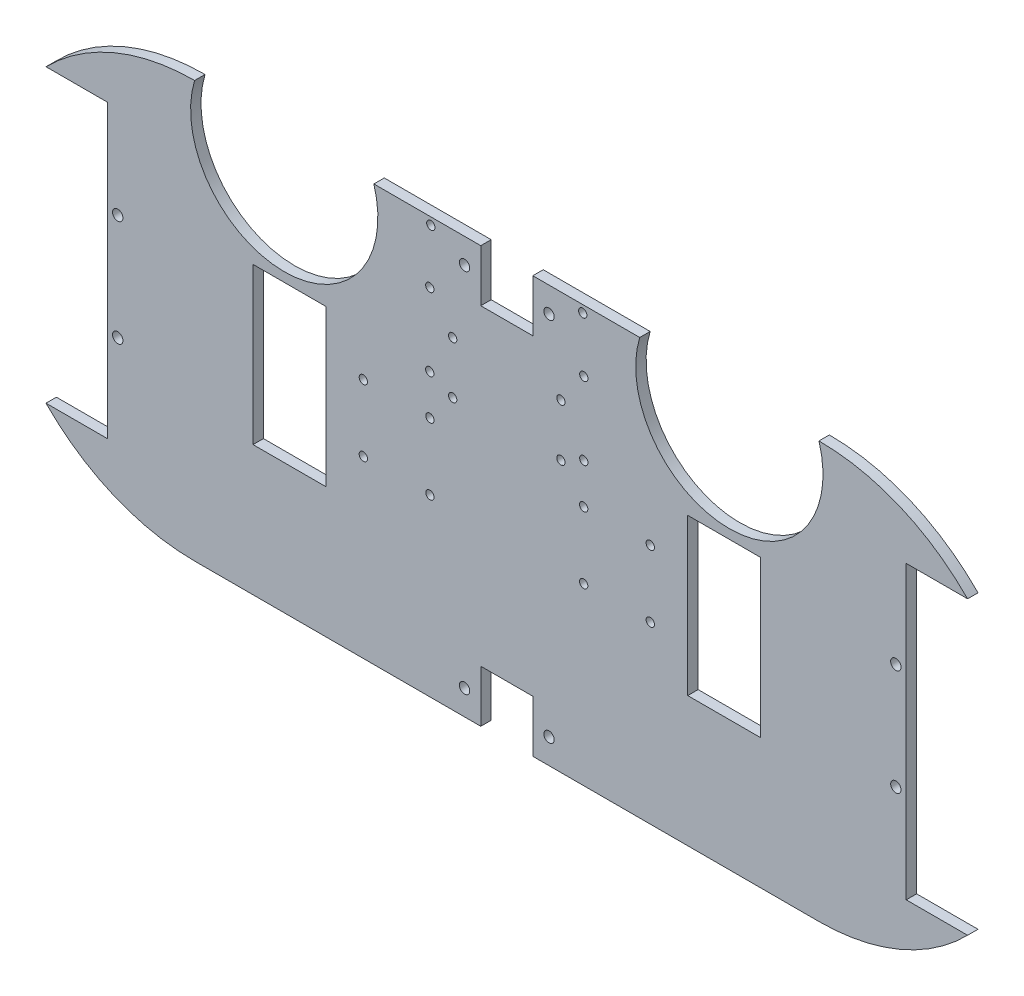
from build123d import *

# Parameters (mm, degrees)
SKETCH1_R           = 2
BOSS_EXTRUDE1_DEPTH = 5
SKETCH2_R           = 2.5
SKETCH2_W           = 35
SKETCH2_H           = 75
CUT_EXTRUDE1_DEPTH  = 10
SKETCH4_R           = 2
CUT_EXTRUDE3_DEPTH  = 10
SKETCH5_R           = 2.5
CUT_EXTRUDE4_DEPTH  = 10
SKETCH6_W           = 25
SKETCH6_H           = 25
CUT_EXTRUDE5_DEPTH  = 10


with BuildPart() as part:
    # Sketch1 → Boss-Extrude1 (new body)
    with BuildSketch(Plane.XY):
        with BuildLine():
            Line((77, 150.635083269), (106.477021815, 150.635083269))
            ThreePointArc((106.477021815, 150.635083269), (73.792570992, 172.830527842), (35.06273753, 180.635083269))
            ThreePointArc((35.06273753, 180.635083269), (-7.999345575, 122.571508006), (-51.06142868, 180.635083269))
            Line((-51.06142868, 180.635083269), (-178.81309626, 180.635083269))
            ThreePointArc((-178.81309626, 180.635083269), (-221.875179365, 122.571508006), (-264.93726247, 180.635083269))
            ThreePointArc((-264.93726247, 180.635083269), (-303.667095932, 172.830527842), (-336.351546756, 150.635083269))
            Line((-336.351546756, 150.635083269), (-306.874524941, 150.635083269))
            Line((-306.874524941, 150.635083269), (-306.874524941, 10.635083269))
            Line((-306.874524941, 10.635083269), (-336.351546756, 10.635083269))
            ThreePointArc((-336.351546756, 10.635083269), (-303.667095932, -11.560361304), (-264.93726247, -19.364916731))
            Line((-264.93726247, -19.364916731), (35.06273753, -19.364916731))
            ThreePointArc((35.06273753, -19.364916731), (73.792570992, -11.560361304), (106.477021815, 10.635083269))
            Line((106.477021815, 10.635083269), (77, 10.635083269))
            Line((77, 10.635083269), (77, 150.635083269))
        make_face()
        with Locations((-151.935, 116.015296492)):
            Circle(SKETCH1_R, mode=Mode.SUBTRACT)
        with Locations((-140.936318375, 110.635083269)):
            Circle(SKETCH1_R, mode=Mode.SUBTRACT)
        with Locations((-140.936318375, 135.635083269)):
            Circle(SKETCH1_R, mode=Mode.SUBTRACT)
        with Locations((-151.935, 151.015296492)):
            Circle(SKETCH1_R, mode=Mode.SUBTRACT)
        with Locations((-151.436318375, 177.135083269)):
            Circle(SKETCH1_R, mode=Mode.SUBTRACT)
        with Locations((-88.936318375, 110.635083269)):
            Circle(SKETCH1_R, mode=Mode.SUBTRACT)
        with Locations((-77.935, 116.015296492)):
            Circle(SKETCH1_R, mode=Mode.SUBTRACT)
        with Locations((-88.936318375, 135.635083269)):
            Circle(SKETCH1_R, mode=Mode.SUBTRACT)
        with Locations((-77.935, 151.015296492)):
            Circle(SKETCH1_R, mode=Mode.SUBTRACT)
        with Locations((-78.436318375, 177.135083269)):
            Circle(SKETCH1_R, mode=Mode.SUBTRACT)
    extrude(amount=-BOSS_EXTRUDE1_DEPTH)

    # Sketch2 → Cut-Extrude1 (cut)
    with BuildSketch(Plane(origin=(0, 0, -5), x_dir=(-1, 0, 0), z_dir=(0, 0, -1))):
        with Locations((301.874524941, 106.135083269)):
            Circle(SKETCH2_R)
        with Locations(Location((301.874524941, 55.135083269, 0), (0, 0, 180))):
            Circle(SKETCH2_R)
        with Locations((-72, 55.135083269)):
            Circle(SKETCH2_R)
        with Locations(Location((-72, 106.135083269, 0), (0, 0, 180))):
            Circle(SKETCH2_R)
        with Locations((219.374524941, 80.635083269)):
            Rectangle(SKETCH2_W, SKETCH2_H)
        with Locations((10.5, 80.635083269)):
            Rectangle(SKETCH2_W, SKETCH2_H)
    extrude(amount=-CUT_EXTRUDE1_DEPTH, mode=Mode.SUBTRACT)

    # Sketch4 → Cut-Extrude3 (cut)
    with BuildSketch(Plane(origin=(0, 0, -5), x_dir=(-1, 0, 0), z_dir=(0, 0, -1))):
        with Locations((46, 64.695083269)):
            Circle(SKETCH4_R)
        with Locations((46, 96.695083269)):
            Circle(SKETCH4_R)
        with Locations((78, 64.695083269)):
            Circle(SKETCH4_R)
        with Locations((78, 96.695083269)):
            Circle(SKETCH4_R)
        with Locations(Location((151.874524941, 64.695083269, 0), (0, 0, 180))):
            Circle(SKETCH4_R)
        with Locations(Location((183.874524941, 64.695083269, 0), (0, 0, 180))):
            Circle(SKETCH4_R)
        with Locations(Location((183.874524941, 96.695083269, 0), (0, 0, 180))):
            Circle(SKETCH4_R)
        with Locations(Location((151.874524941, 96.695083269, 0), (0, 0, 180))):
            Circle(SKETCH4_R)
    extrude(amount=-CUT_EXTRUDE3_DEPTH, mode=Mode.SUBTRACT)

    # Sketch5 → Cut-Extrude4 (cut)
    with BuildSketch(Plane(origin=(0, 0, -5), x_dir=(-1, 0, 0), z_dir=(0, 0, -1))):
        with Locations((94.63726247, 168.635083269)):
            Circle(SKETCH5_R)
        with Locations((135.23726247, 168.635083269)):
            Circle(SKETCH5_R)
        with Locations(Location((94.63726247, -7.364916731, 0), (0, 0, 180))):
            Circle(SKETCH5_R)
        with Locations(Location((135.23726247, -7.364916731, 0), (0, 0, 180))):
            Circle(SKETCH5_R)
    extrude(amount=-CUT_EXTRUDE4_DEPTH, mode=Mode.SUBTRACT)

    # Sketch6 → Cut-Extrude5 (cut)
    with BuildSketch(Plane(origin=(0, 0, -5), x_dir=(-1, 0, 0), z_dir=(0, 0, -1))):
        with Locations((114.939524941, -6.864916731)):
            Rectangle(SKETCH6_W, SKETCH6_H)
        with Locations((114.939524941, 168.135083269)):
            Rectangle(SKETCH6_W, SKETCH6_H)
    extrude(amount=-CUT_EXTRUDE5_DEPTH, mode=Mode.SUBTRACT)


solid = part.part
